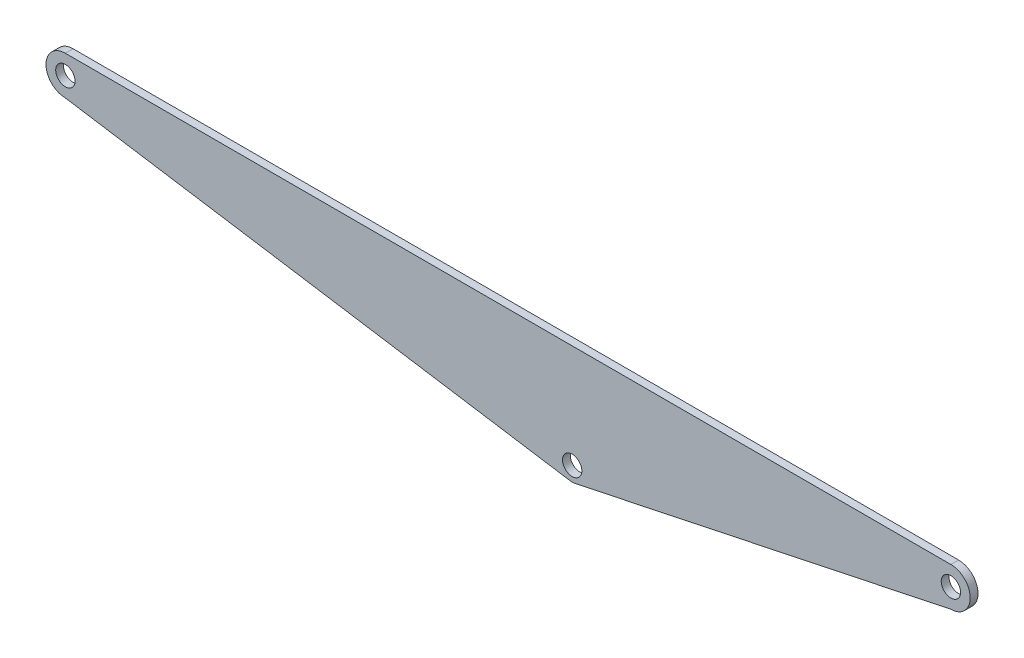
from build123d import *

# Parameters (mm, degrees)
SKETCH1_R           = 6.35
BOSS_EXTRUDE1_DEPTH = 5.08


with BuildPart() as part:
    # Sketch1 → Boss-Extrude1 (new body)
    with BuildSketch(Plane.XY):
        with BuildLine():
            Line((-580.7, 12.7), (0, 12.7))
            ThreePointArc((0, 12.7), (12.7, 0), (0, -12.7))
            Line((0, -12.7), (-246.387841786, -64.485872398))
            ThreePointArc((-246.387841786, -64.485872398), (-248.101037656, -64.686359692), (-249.822299661, -64.574590494))
            Line((-249.822299661, -64.574590494), (-580.7, -12.7))
            ThreePointArc((-580.7, -12.7), (-593.4, 0), (-580.7, 12.7))
        make_face()
        Circle(SKETCH1_R, mode=Mode.SUBTRACT)
        with Locations((-580.7, 0)):
            Circle(SKETCH1_R, mode=Mode.SUBTRACT)
        with Locations((-248.347003133, -55.164536023)):
            Circle(SKETCH1_R, mode=Mode.SUBTRACT)
    extrude(amount=-BOSS_EXTRUDE1_DEPTH)


solid = part.part
